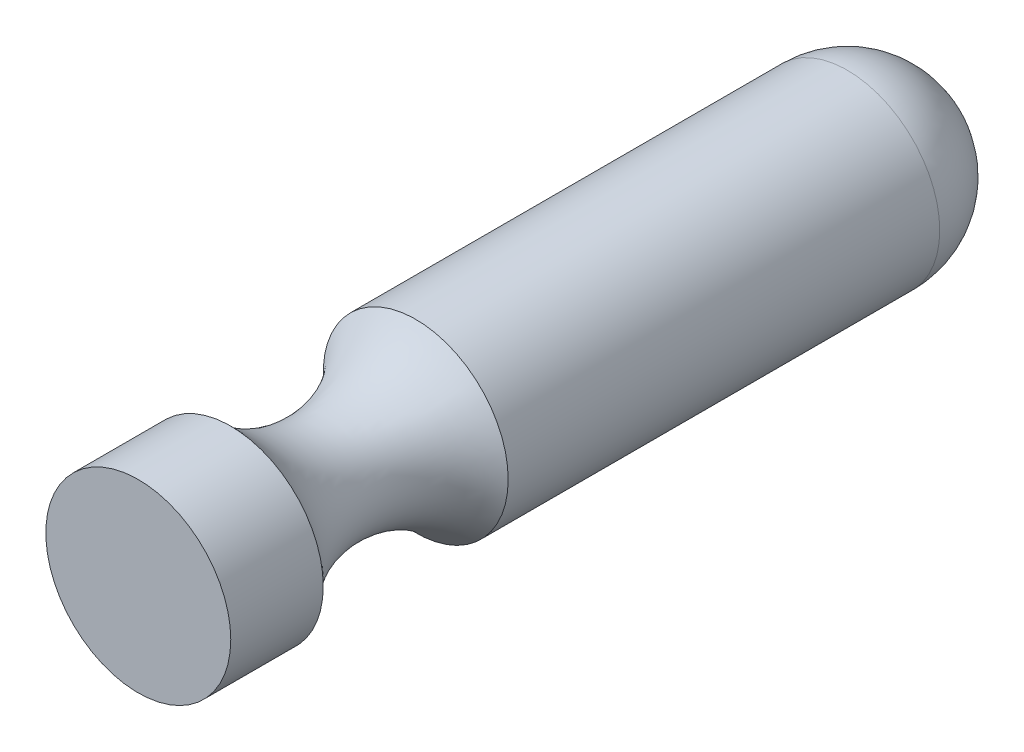
from build123d import *


with BuildPart() as part:
    # Sketch1 → Revolve1 (revolve)
    with BuildSketch(Plane(origin=(0, 0, 0), x_dir=(1, 0, 0), z_dir=(0, 1, 0))):
        with BuildLine():
            Line((0, 0), (19.05, 0))
            Line((19.05, 0), (19.05, 19.05))
            ThreePointArc((19.05, 19.05), (10.450520825, 38.1), (19.05, 57.15))
            Line((19.05, 57.15), (19.05, 146.05))
            ThreePointArc((19.05, 146.05), (13.470384182, 159.520384182), (0, 165.1))
            Line((0, 165.1), (0, 0))
        make_face()
    revolve(axis=Axis((0, 0, 0), (0, 0, -1)))


solid = part.part
